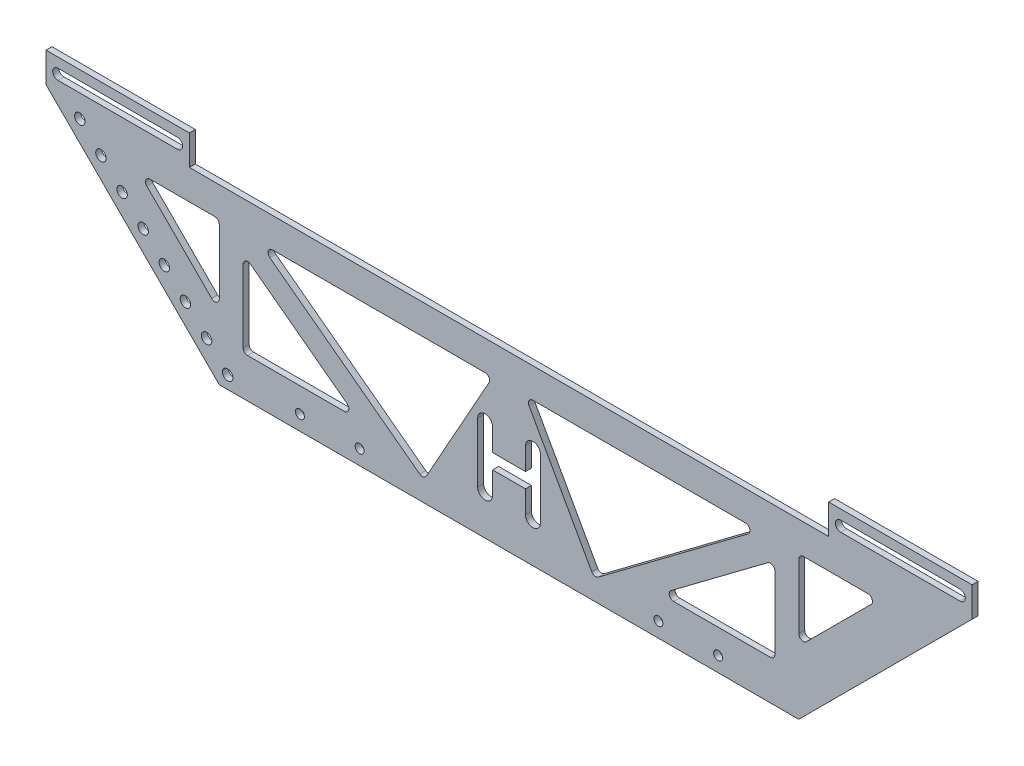
from build123d import *

# Parameters (mm, degrees)
SKETCH_1_R               = 1.5
EXTRUDE_1_DEPTH          = 2
SKETCH_3_W               = 310
SKETCH_3_H               = 20
CUT_EXTRUDE_2_DEPTH      = 166.508307949
CUT_EXTRUDE_3_DEPTH      = 166.508307949
CUT_EXTRUDE_3_DEPTH_BACK = 166.508307949
CUT_EXTRUDE_4_DEPTH      = 166.508307949
CUT_EXTRUDE_6_DEPTH      = 166.508307949


with BuildPart() as part:
    # 草图1 → 凸台-拉伸1 (new body)
    with BuildSketch(Plane.XY):
        Polygon((-107, 30), (-107, 0), (107, 0), (107, 30), (155, 30), (155, 0), (97, -58), (-97, -58), (-155, 0), (-155, 30), align=None)
        with Locations((-151, 25)):
            Circle(SKETCH_1_R, mode=Mode.SUBTRACT)
        with Locations((-111, 25)):
            Circle(SKETCH_1_R, mode=Mode.SUBTRACT)
        with Locations((-111, 5)):
            Circle(SKETCH_1_R, mode=Mode.SUBTRACT)
        with Locations((-151, 5)):
            Circle(SKETCH_1_R, mode=Mode.SUBTRACT)
        with Locations(Location((151, 5, 0), (0, 0, 180))):
            Circle(SKETCH_1_R, mode=Mode.SUBTRACT)
        with Locations(Location((111, 5, 0), (0, 0, 180))):
            Circle(SKETCH_1_R, mode=Mode.SUBTRACT)
        with Locations(Location((111, 25, 0), (0, 0, 180))):
            Circle(SKETCH_1_R, mode=Mode.SUBTRACT)
        with Locations(Location((151, 25, 0), (0, 0, 180))):
            Circle(SKETCH_1_R, mode=Mode.SUBTRACT)
        with Locations((-70, -53)):
            Circle(SKETCH_1_R, mode=Mode.SUBTRACT)
        with Locations((-50, -53)):
            Circle(SKETCH_1_R, mode=Mode.SUBTRACT)
        with Locations(Location((50, -53, 0), (0, 0, 180))):
            Circle(SKETCH_1_R, mode=Mode.SUBTRACT)
        with Locations(Location((70, -53, 0), (0, 0, 180))):
            Circle(SKETCH_1_R, mode=Mode.SUBTRACT)
    extrude(amount=EXTRUDE_1_DEPTH)

    # 草图3 → 切除-拉伸2 (cut, through all)
    with BuildSketch(Plane.XY.offset(2)):
        with Locations((0, 20)):
            Rectangle(SKETCH_3_W, SKETCH_3_H)
    extrude(amount=-CUT_EXTRUDE_2_DEPTH, mode=Mode.SUBTRACT)

    # 草图4 → 切除-拉伸3 (cut, two sides: drawn at the far end of the back side and taken through both)
    with BuildSketch(Plane.XY.offset(2).offset(-CUT_EXTRUDE_3_DEPTH_BACK)):
        with BuildLine():
            Line((5.5, -31.928047473), (0, -31.928047473))
            Line((0, -31.928047473), (0, -36.928047473))
            Line((0, -36.928047473), (5.5, -36.928047473))
            Line((5.5, -36.928047473), (5.5, -44.428047473))
            ThreePointArc((5.5, -44.428047473), (8, -46.928047473), (10.5, -44.428047473))
            Line((10.5, -44.428047473), (10.5, -24.428047473))
            ThreePointArc((10.5, -24.428047473), (8, -21.928047473), (5.5, -24.428047473))
            Line((5.5, -24.428047473), (5.5, -31.928047473))
        make_face()
        with BuildLine():
            Line((0, -36.928047473), (0, -31.928047473))
            Line((0, -31.928047473), (-5.5, -31.928047473))
            Line((-5.5, -31.928047473), (-5.5, -24.428047473))
            ThreePointArc((-5.5, -24.428047473), (-8, -21.928047473), (-10.5, -24.428047473))
            Line((-10.5, -24.428047473), (-10.5, -44.428047473))
            ThreePointArc((-10.5, -44.428047473), (-8, -46.928047473), (-5.5, -44.428047473))
            Line((-5.5, -44.428047473), (-5.5, -36.928047473))
            Line((-5.5, -36.928047473), (0, -36.928047473))
        make_face()
        with BuildLine():
            Line((-79.166666667, -10), (-8, -10))
            ThreePointArc((-8, -10), (-6.706444076, -10.74058373), (-6.690203447, -12.231049239))
            Line((-6.690203447, -12.231049239), (-27.690203447, -49.856049239))
            ThreePointArc((-27.690203447, -49.856049239), (-28.688612769, -50.592323411), (-29.9, -50.325))
            Line((-29.9, -50.325), (-80.066666667, -12.7))
            ThreePointArc((-80.066666667, -12.7), (-80.589691614, -11.025658351), (-79.166666667, -10))
        make_face()
        with BuildLine():
            ThreePointArc((-89, -19), (-88.170820393, -17.658359214), (-86.6, -17.8))
            Line((-86.6, -17.8), (-54.217604581, -42.086796564))
            ThreePointArc((-54.217604581, -42.086796564), (-53.694579634, -43.761138213), (-55.117604581, -44.786796564))
            Line((-55.117604581, -44.786796564), (-87.5, -44.786796564))
            ThreePointArc((-87.5, -44.786796564), (-88.560660172, -44.347456736), (-89, -43.286796564))
            Line((-89, -43.286796564), (-89, -19))
        make_face()
        with BuildLine():
            ThreePointArc((-121.226136393, -12.560660172), (-121.55129552, -10.925974851), (-120.165476221, -10))
            Line((-120.165476221, -10), (-98.5, -10))
            ThreePointArc((-98.5, -10), (-97.439339828, -10.439339828), (-97, -11.5))
            Line((-97, -11.5), (-97, -33.165476221))
            ThreePointArc((-97, -33.165476221), (-97.925974851, -34.55129552), (-99.560660172, -34.226136393))
            Line((-99.560660172, -34.226136393), (-121.226136393, -12.560660172))
        make_face()
        with BuildLine():
            Line((79.166666667, -10), (8, -10))
            ThreePointArc((8, -10), (6.706444076, -10.74058373), (6.690203447, -12.231049239))
            Line((6.690203447, -12.231049239), (27.690203447, -49.856049239))
            ThreePointArc((27.690203447, -49.856049239), (28.688612769, -50.592323411), (29.9, -50.325))
            Line((29.9, -50.325), (80.066666667, -12.7))
            ThreePointArc((80.066666667, -12.7), (80.589691614, -11.025658351), (79.166666667, -10))
        make_face()
        with BuildLine():
            ThreePointArc((55.117604581, -44.786796564), (53.694579634, -43.761138213), (54.217604581, -42.086796564))
            Line((54.217604581, -42.086796564), (86.6, -17.8))
            ThreePointArc((86.6, -17.8), (88.170820393, -17.658359214), (89, -19))
            Line((89, -19), (89, -43.286796564))
            ThreePointArc((89, -43.286796564), (88.560660172, -44.347456736), (87.5, -44.786796564))
            Line((87.5, -44.786796564), (55.117604581, -44.786796564))
        make_face()
        with BuildLine():
            ThreePointArc((99.560660172, -34.226136393), (97.925974851, -34.55129552), (97, -33.165476221))
            Line((97, -33.165476221), (97, -11.5))
            ThreePointArc((97, -11.5), (97.439339828, -10.439339828), (98.5, -10))
            Line((98.5, -10), (120.165476221, -10))
            ThreePointArc((120.165476221, -10), (121.55129552, -10.925974851), (121.226136393, -12.560660172))
            Line((121.226136393, -12.560660172), (99.560660172, -34.226136393))
        make_face()
    extrude(amount=CUT_EXTRUDE_3_DEPTH + CUT_EXTRUDE_3_DEPTH_BACK, mode=Mode.SUBTRACT)

    # 草图5 → 切除-拉伸4 (cut, through all)
    with BuildSketch(Plane.XY.offset(2)):
        with BuildLine():
            Line((-151, 6.75), (-111, 6.75))
            ThreePointArc((-111, 6.75), (-109.25, 5), (-111, 3.25))
            Line((-111, 3.25), (-151, 3.25))
            ThreePointArc((-151, 3.25), (-152.75, 5), (-151, 6.75))
        make_face()
        with BuildLine():
            Line((111, 6.75), (151, 6.75))
            ThreePointArc((151, 6.75), (152.75, 5), (151, 3.25))
            Line((151, 3.25), (111, 3.25))
            ThreePointArc((111, 3.25), (109.25, 5), (111, 6.75))
        make_face()
    extrude(amount=-CUT_EXTRUDE_4_DEPTH, mode=Mode.SUBTRACT)

    # 草图7 → 切除-拉伸6 (cut, through all)
    with BuildSketch(Plane.XY.offset(2)):
        with BuildLine():
            ThreePointArc((-92.430194847, -53.748737342), (-93.51049884, -52.13194816), (-95.417631714, -52.511300474))
            Line((-95.417631714, -52.511300474), (-94.180194847, -53.748737342))
            Line((-94.180194847, -53.748737342), (-92.94275798, -54.986174209))
            ThreePointArc((-92.94275798, -54.986174209), (-92.563405665, -54.418433348), (-92.430194847, -53.748737342))
        make_face()
        with BuildLine():
            Line((-94.180194847, -53.748737342), (-95.417631714, -52.511300474))
            ThreePointArc((-95.417631714, -52.511300474), (-95.417631714, -54.986174209), (-92.94275798, -54.986174209))
            Line((-92.94275798, -54.986174209), (-94.180194847, -53.748737342))
        make_face()
        with BuildLine():
            ThreePointArc((-99.501262658, -46.67766953), (-100.581566652, -45.060880348), (-102.488699526, -45.440232663))
            Line((-102.488699526, -45.440232663), (-101.251262658, -46.67766953))
            Line((-101.251262658, -46.67766953), (-100.013825791, -47.915106397))
            ThreePointArc((-100.013825791, -47.915106397), (-99.634473477, -47.347365536), (-99.501262658, -46.67766953))
        make_face()
        with BuildLine():
            Line((-101.251262658, -46.67766953), (-102.488699526, -45.440232663))
            ThreePointArc((-102.488699526, -45.440232663), (-102.488699526, -47.915106397), (-100.013825791, -47.915106397))
            Line((-100.013825791, -47.915106397), (-101.251262658, -46.67766953))
        make_face()
        with BuildLine():
            ThreePointArc((-106.57233047, -39.606601718), (-107.652634464, -37.989812536), (-109.559767337, -38.369164851))
            Line((-109.559767337, -38.369164851), (-108.32233047, -39.606601718))
            Line((-108.32233047, -39.606601718), (-107.084893603, -40.844038585))
            ThreePointArc((-107.084893603, -40.844038585), (-106.705541288, -40.276297724), (-106.57233047, -39.606601718))
        make_face()
        with BuildLine():
            Line((-108.32233047, -39.606601718), (-109.559767337, -38.369164851))
            ThreePointArc((-109.559767337, -38.369164851), (-109.559767337, -40.844038585), (-107.084893603, -40.844038585))
            Line((-107.084893603, -40.844038585), (-108.32233047, -39.606601718))
        make_face()
        with BuildLine():
            ThreePointArc((-113.643398282, -32.535533906), (-114.723702276, -30.918744724), (-116.630835149, -31.298097039))
            Line((-116.630835149, -31.298097039), (-115.393398282, -32.535533906))
            Line((-115.393398282, -32.535533906), (-114.155961415, -33.772970773))
            ThreePointArc((-114.155961415, -33.772970773), (-113.7766091, -33.205229913), (-113.643398282, -32.535533906))
        make_face()
        with BuildLine():
            Line((-115.393398282, -32.535533906), (-116.630835149, -31.298097039))
            ThreePointArc((-116.630835149, -31.298097039), (-116.630835149, -33.772970773), (-114.155961415, -33.772970773))
            Line((-114.155961415, -33.772970773), (-115.393398282, -32.535533906))
        make_face()
        with BuildLine():
            ThreePointArc((-120.714466094, -25.464466094), (-121.794770087, -23.847676912), (-123.701902961, -24.227029227))
            Line((-123.701902961, -24.227029227), (-122.464466094, -25.464466094))
            Line((-122.464466094, -25.464466094), (-121.227029227, -26.701902961))
            ThreePointArc((-121.227029227, -26.701902961), (-120.847676912, -26.134162101), (-120.714466094, -25.464466094))
        make_face()
        with BuildLine():
            Line((-122.464466094, -25.464466094), (-123.701902961, -24.227029227))
            ThreePointArc((-123.701902961, -24.227029227), (-124.214466094, -25.464466094), (-123.701902961, -26.701902961))
            Line((-123.701902961, -26.701902961), (-122.464466094, -25.464466094))
        make_face()
        with BuildLine():
            Line((-121.227029227, -26.701902961), (-122.464466094, -25.464466094))
            Line((-122.464466094, -25.464466094), (-123.701902961, -26.701902961))
            ThreePointArc((-123.701902961, -26.701902961), (-122.464466094, -27.214466094), (-121.227029227, -26.701902961))
        make_face()
        with BuildLine():
            ThreePointArc((-127.785533906, -18.393398282), (-128.865837899, -16.7766091), (-130.772970773, -17.155961415))
            Line((-130.772970773, -17.155961415), (-129.535533906, -18.393398282))
            Line((-129.535533906, -18.393398282), (-128.298097039, -19.630835149))
            ThreePointArc((-128.298097039, -19.630835149), (-127.918744724, -19.063094289), (-127.785533906, -18.393398282))
        make_face()
        with BuildLine():
            Line((-129.535533906, -18.393398282), (-130.772970773, -17.155961415))
            ThreePointArc((-130.772970773, -17.155961415), (-130.772970773, -19.630835149), (-128.298097039, -19.630835149))
            Line((-128.298097039, -19.630835149), (-129.535533906, -18.393398282))
        make_face()
        with BuildLine():
            ThreePointArc((-134.856601718, -11.32233047), (-135.936905711, -9.705541288), (-137.844038585, -10.084893603))
            Line((-137.844038585, -10.084893603), (-136.606601718, -11.32233047))
            Line((-136.606601718, -11.32233047), (-135.369164851, -12.559767337))
            ThreePointArc((-135.369164851, -12.559767337), (-134.989812536, -11.992026477), (-134.856601718, -11.32233047))
        make_face()
        with BuildLine():
            Line((-136.606601718, -11.32233047), (-137.844038585, -10.084893603))
            ThreePointArc((-137.844038585, -10.084893603), (-137.844038585, -12.559767337), (-135.369164851, -12.559767337))
            Line((-135.369164851, -12.559767337), (-136.606601718, -11.32233047))
        make_face()
        with BuildLine():
            ThreePointArc((-141.92766953, -4.251262658), (-143.007973523, -2.634473477), (-144.915106397, -3.013825791))
            Line((-144.915106397, -3.013825791), (-143.67766953, -4.251262658))
            Line((-143.67766953, -4.251262658), (-142.440232663, -5.488699526))
            ThreePointArc((-142.440232663, -5.488699526), (-142.060880348, -4.920958665), (-141.92766953, -4.251262658))
        make_face()
        with BuildLine():
            Line((-143.67766953, -4.251262658), (-144.915106397, -3.013825791))
            ThreePointArc((-144.915106397, -3.013825791), (-144.915106397, -5.488699526), (-142.440232663, -5.488699526))
            Line((-142.440232663, -5.488699526), (-143.67766953, -4.251262658))
        make_face()
    extrude(amount=-CUT_EXTRUDE_6_DEPTH, mode=Mode.SUBTRACT)


solid = part.part
